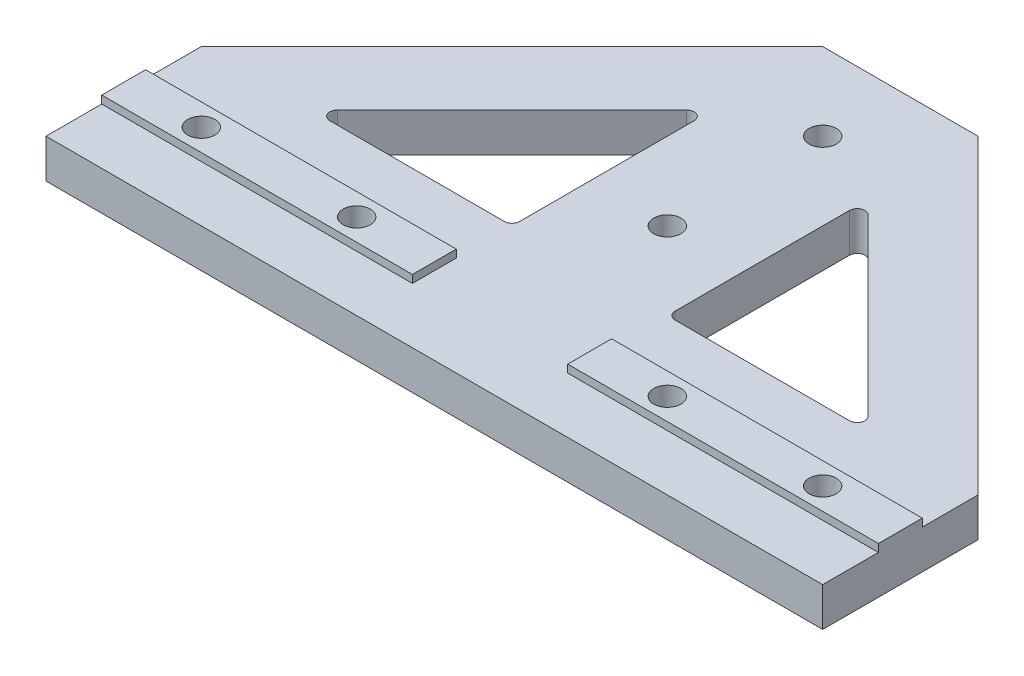
from build123d import *

# Parameters (mm, degrees)
ESBO_O1_R                = 1.75
RESSALTO_EXTRUS_O1_DEPTH = 5
ESBO_O3_W                = 40
ESBO_O3_H                = 5.65
ESBO_O3_R                = 1.75
RESSALTO_EXTRUS_O2_DEPTH = 1


with BuildPart() as part:
    # Esboço1 → Ressalto-extrusão1 (new body)
    with BuildSketch(Plane(origin=(0, 0, 0), x_dir=(1, 0, 0), z_dir=(0, 1, 0))):
        Polygon((-50, 0), (-50, 20.000002677), (-9.999996661, 60.000002546), (9.999996661, 60.000002546), (50, 20.000002677), (50, 0), align=None)
        with Locations(Location((-40, 10.000001339, 0), (0, 0, 270))):
            Circle(ESBO_O1_R, mode=Mode.SUBTRACT)
        with Locations(Location((-20, 10.000001339, 0), (0, 0, 270))):
            Circle(ESBO_O1_R, mode=Mode.SUBTRACT)
        with Locations(Location((0, 50.000002546, 0), (0, 0, 270))):
            Circle(ESBO_O1_R, mode=Mode.SUBTRACT)
        with Locations(Location((0, 30.000002546, 0), (0, 0, 270))):
            Circle(ESBO_O1_R, mode=Mode.SUBTRACT)
        with Locations(Location((20, 10.000001339, 0), (0, 0, 90))):
            Circle(ESBO_O1_R, mode=Mode.SUBTRACT)
        with Locations(Location((40, 10.000001339, 0), (0, 0, 90))):
            Circle(ESBO_O1_R, mode=Mode.SUBTRACT)
        with BuildLine():
            Line((-10, 43.443650782), (-10, 21.000001339))
            ThreePointArc((-10, 21.000001339), (-10.292893219, 20.292894558), (-11, 20.000001339))
            Line((-11, 20.000001339), (-33.443651391, 20.000001339))
            ThreePointArc((-33.443651391, 20.000001339), (-34.367530932, 20.617317926), (-34.150758141, 21.707108151))
            Line((-34.150758141, 21.707108151), (-11.707106751, 44.150757594))
            ThreePointArc((-11.707106751, 44.150757594), (-10.617316548, 44.367530307), (-10, 43.443650782))
        make_face(mode=Mode.SUBTRACT)
        with BuildLine():
            Line((11.707106751, 44.150757594), (34.150758141, 21.707108151))
            ThreePointArc((34.150758141, 21.707108151), (34.367530932, 20.617317926), (33.443651391, 20.000001339))
            Line((33.443651391, 20.000001339), (11, 20.000001339))
            ThreePointArc((11, 20.000001339), (10.292893219, 20.292894558), (10, 21.000001339))
            Line((10, 21.000001339), (10, 43.443650782))
            ThreePointArc((10, 43.443650782), (10.617316548, 44.367530307), (11.707106751, 44.150757594))
        make_face(mode=Mode.SUBTRACT)
    extrude(amount=RESSALTO_EXTRUS_O1_DEPTH)

    # Esboço3 → Ressalto-extrusão2 (add)
    # profile 1 of 2: a face of its own
    with BuildSketch(Plane(origin=(0, 5, 0), x_dir=(1, 0, 0), z_dir=(0, 1, 0))):
        with Locations((-30, 10.000001339)):
            Rectangle(ESBO_O3_W, ESBO_O3_H)
        with Locations(Location((-40, 10.000001339, 0), (0, 0, 270))):
            Circle(ESBO_O3_R, mode=Mode.SUBTRACT)
        with Locations(Location((-20, 10.000001339, 0), (0, 0, 270))):
            Circle(ESBO_O3_R, mode=Mode.SUBTRACT)
    # profile 2 of 2: a face of its own
    with BuildSketch(Plane(origin=(0, 5, 0), x_dir=(1, 0, 0), z_dir=(0, 1, 0))):
        with Locations((30, 10.000001339)):
            Rectangle(ESBO_O3_W, ESBO_O3_H)
        with Locations(Location((20, 10.000001339, 0), (0, 0, 90))):
            Circle(ESBO_O3_R, mode=Mode.SUBTRACT)
        with Locations(Location((40, 10.000001339, 0), (0, 0, 90))):
            Circle(ESBO_O3_R, mode=Mode.SUBTRACT)
    extrude(amount=RESSALTO_EXTRUS_O2_DEPTH)


solid = part.part
